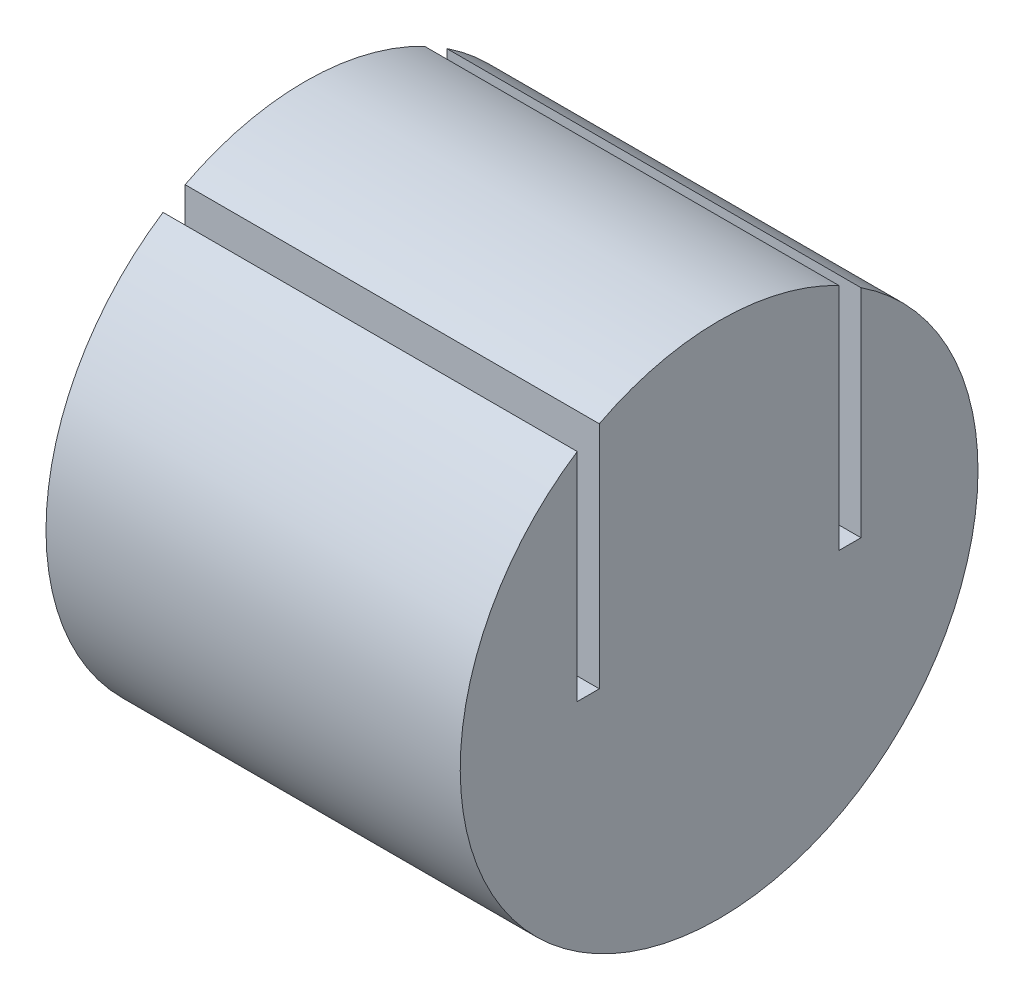
from build123d import *

# Parameters (mm, degrees)
BOSS_EXTRUDE1_DEPTH = 15.24


with BuildPart() as part:
    # Sketch1 → Boss-Extrude1 (new body)
    with BuildSketch(Plane(origin=(0, 0, 0), x_dir=(0, 0, -1), z_dir=(1, 0, 0))):
        with BuildLine():
            Line((-4.4069, 8.444220354), (-4.4069, 0))
            Line((-4.4069, 0), (4.4069, 0))
            Line((4.4069, 0), (4.4069, 8.444220354))
            ThreePointArc((4.4069, 8.444220354), (0, 9.525), (-4.4069, 8.444220354))
        make_face()
        with BuildLine():
            Line((4.4069, 0), (-4.4069, 0))
            Line((-4.4069, 0), (-5.2197, 0))
            Line((-5.2197, 0), (-5.2197, 7.967456113))
            ThreePointArc((-5.2197, 7.967456113), (-4.528133307, -8.379834948), (9.525, 0))
            ThreePointArc((9.525, 0), (8.379834948, 4.528133307), (5.2197, 7.967456113))
            Line((5.2197, 7.967456113), (5.2197, 0))
            Line((5.2197, 0), (4.4069, 0))
        make_face()
    extrude(amount=BOSS_EXTRUDE1_DEPTH)


solid = part.part
